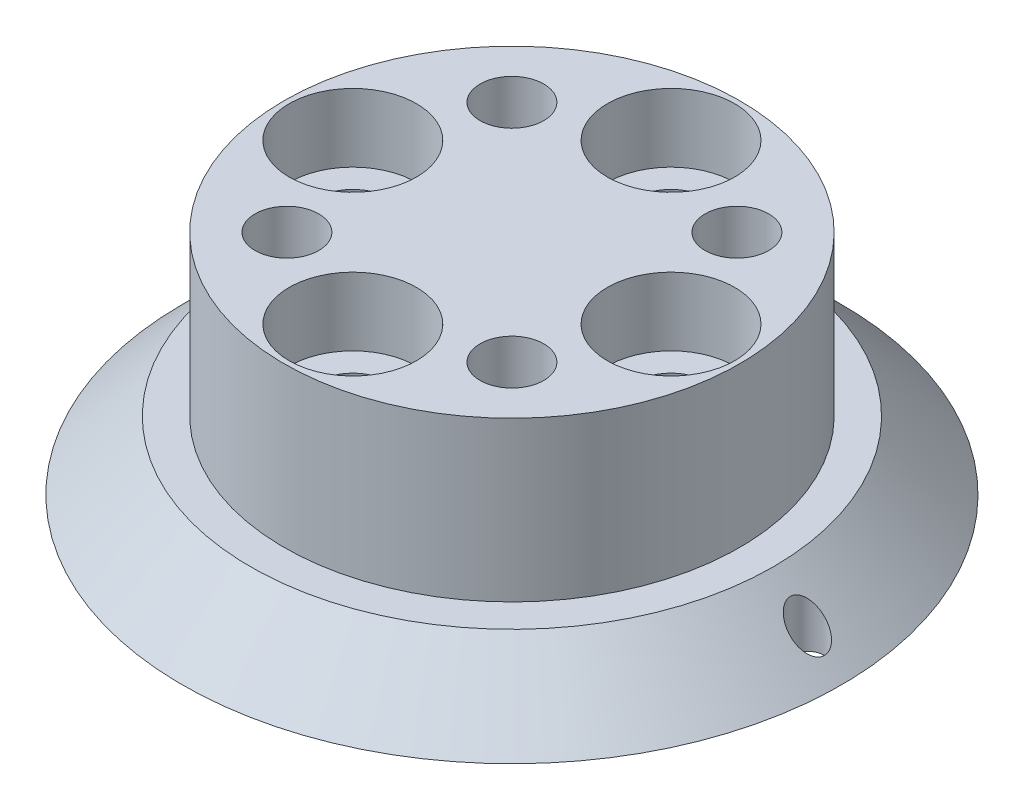
from build123d import *

# Parameters (mm, degrees)
SKETCH2_R                               = 1.4
CUT_EXTRUDE1_DEPTH                      = 23.814469093
CBORE_FOR_M5_HEX_HEAD_BOLT1_D           = 3.2
CBORE_FOR_M5_HEX_HEAD_BOLT1_CBORE_D     = 5.6
CBORE_FOR_M5_HEX_HEAD_BOLT1_CBORE_DEPTH = 3
SKETCH4_R                               = 0.75
CUT_EXTRUDE3_DEPTH                      = 23.814469093


with BuildPart() as part:
    # Sketch1 → Revolve1 (revolve)
    with BuildSketch(Plane.XY, mode=Mode.PRIVATE) as revolve1_sk:
        Polygon((14.5, 0), (11.5, 3), (10.025, 3), (10.025, 10), (0, 10), (0, 0), align=None)
    revolve(revolve1_sk.sketch.rotate(Axis((0, 10, 0), (0, -1, 0)), 180), axis=Axis((0, 10, 0), (0, -1, 0)))

    # Sketch2 → Cut-Extrude1 (cut, through all)
    with BuildSketch(Plane(origin=(0, 10, 0), x_dir=(1, 0, 0), z_dir=(0, 1, 0))):
        with Locations(Location((0, 7, 0), (0, 0, 180))):
            Circle(SKETCH2_R)
        with Locations(Location((4.949747468, 4.949747468, 0), (0, 0, 180))):
            Circle(SKETCH2_R)
        with Locations(Location((7, 0, 0), (0, 0, 180))):
            Circle(SKETCH2_R)
        with Locations(Location((4.949747468, -4.949747468, 0), (0, 0, 180))):
            Circle(SKETCH2_R)
        with Locations(Location((0, -7, 0), (0, 0, 180))):
            Circle(SKETCH2_R)
        with Locations(Location((-4.949747468, -4.949747468, 0), (0, 0, 180))):
            Circle(SKETCH2_R)
        with Locations(Location((-7, 0, 0), (0, 0, 180))):
            Circle(SKETCH2_R)
        with Locations(Location((-4.949747468, 4.949747468, 0), (0, 0, 180))):
            Circle(SKETCH2_R)
    extrude(amount=-CUT_EXTRUDE1_DEPTH, mode=Mode.SUBTRACT)

    # CBORE for M5 Hex Head Bolt1 (through all)
    with Locations(Plane(origin=(0, 10, -7), x_dir=(1, 0, 0), z_dir=(0, 1, 0))):
        with Locations((0, 0), (-7, -7), (0, -14), (7, -7)):
            CounterBoreHole(CBORE_FOR_M5_HEX_HEAD_BOLT1_D / 2, CBORE_FOR_M5_HEX_HEAD_BOLT1_CBORE_D / 2, CBORE_FOR_M5_HEX_HEAD_BOLT1_CBORE_DEPTH)

    # Sketch4 → Cut-Extrude3 (cut, through all)
    with BuildSketch(Plane(origin=(0, 0, 0), x_dir=(1, 0, 0), z_dir=(0, 1, 0))):
        with Locations(Location((13, 0, 0), (0, 0, 90.394644161))):
            Circle(SKETCH4_R)
    extrude(amount=CUT_EXTRUDE3_DEPTH, mode=Mode.SUBTRACT)


solid = part.part
